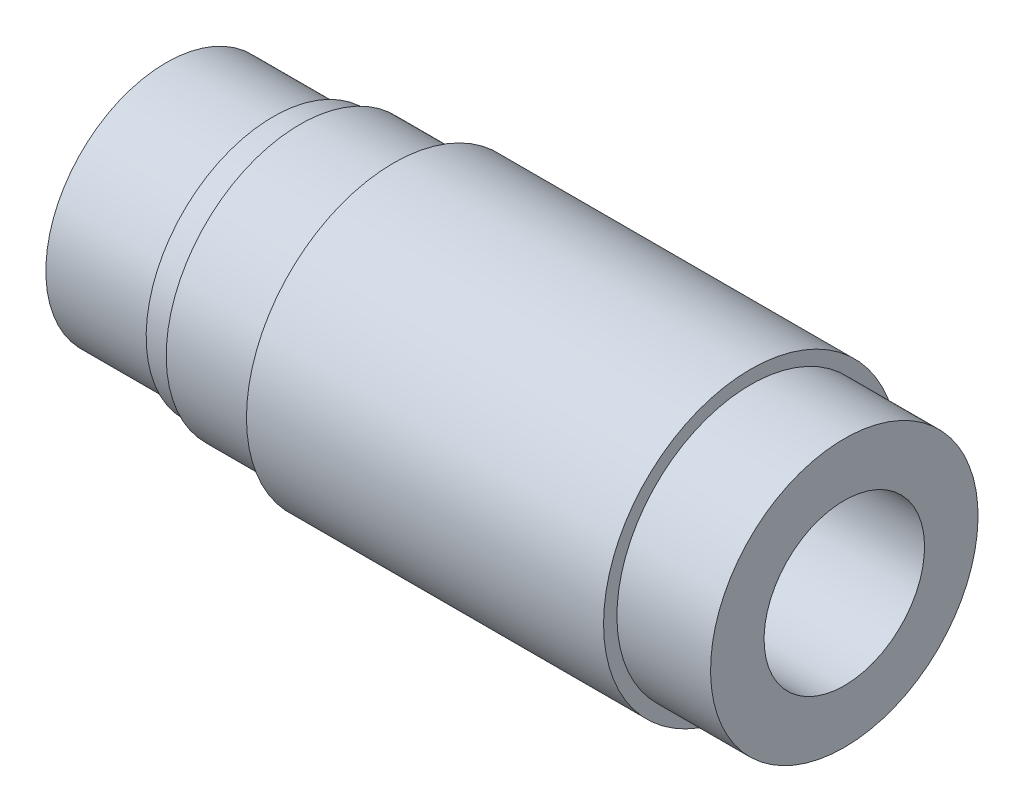
from build123d import *


with BuildPart() as part:
    # Sketch1 → Revolve1 (revolve)
    with BuildSketch(Plane.XY):
        Polygon((8, 9), (0, 9), (0, 6), (50.7, 6), (50.7, 9.5), (50.7, 10), (43.7, 10), (43.7, 11), (17, 11), (17, 10), (10, 10), (10, 9.5), (8, 9.5), align=None)
    revolve(axis=Axis((-4.032198736, 0, 0), (1, 0, 0)))


solid = part.part
